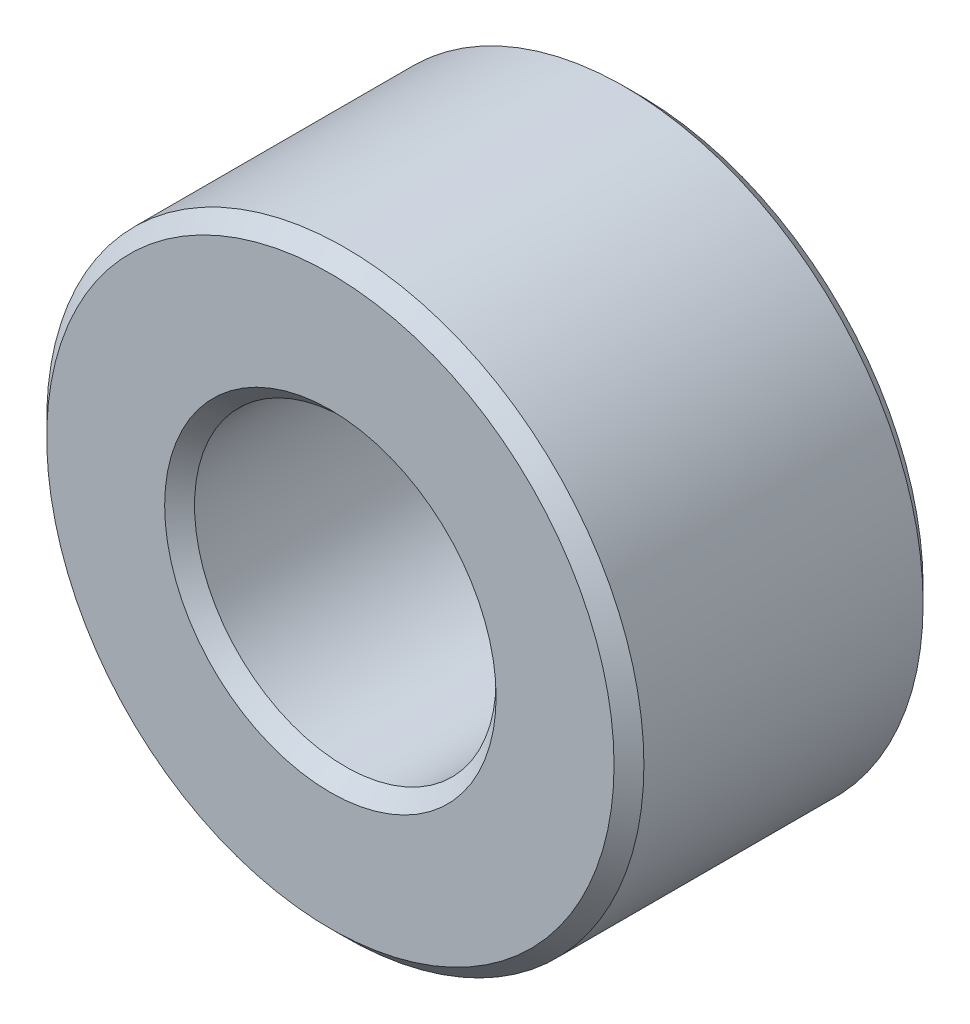
from build123d import *

# Parameters (mm, degrees)
ESBO_O1_R                = 10
ESBO_O1_R_2              = 5.05
RESSALTO_EXTRUS_O1_DEPTH = 5.175
CHANFRO1_SIZE            = 0.5


with BuildPart() as part:
    # Esboço1 → Ressalto-extrusão1 (new, symmetric)
    with BuildSketch(Plane.XY):
        Circle(ESBO_O1_R)
        Circle(ESBO_O1_R_2, mode=Mode.SUBTRACT)
    extrude(amount=RESSALTO_EXTRUS_O1_DEPTH, both=True)

    # Chanfro1
    chanfro1_edges = [part.edges().sort_by_distance(p)[0] for p in [
        (-10, 0, -5.175),
        (-10, 0, 5.175),
        (-5.05, 0, -5.175),
        (-5.05, 0, 5.175),
    ]]
    chamfer(chanfro1_edges, length=CHANFRO1_SIZE)


solid = part.part
